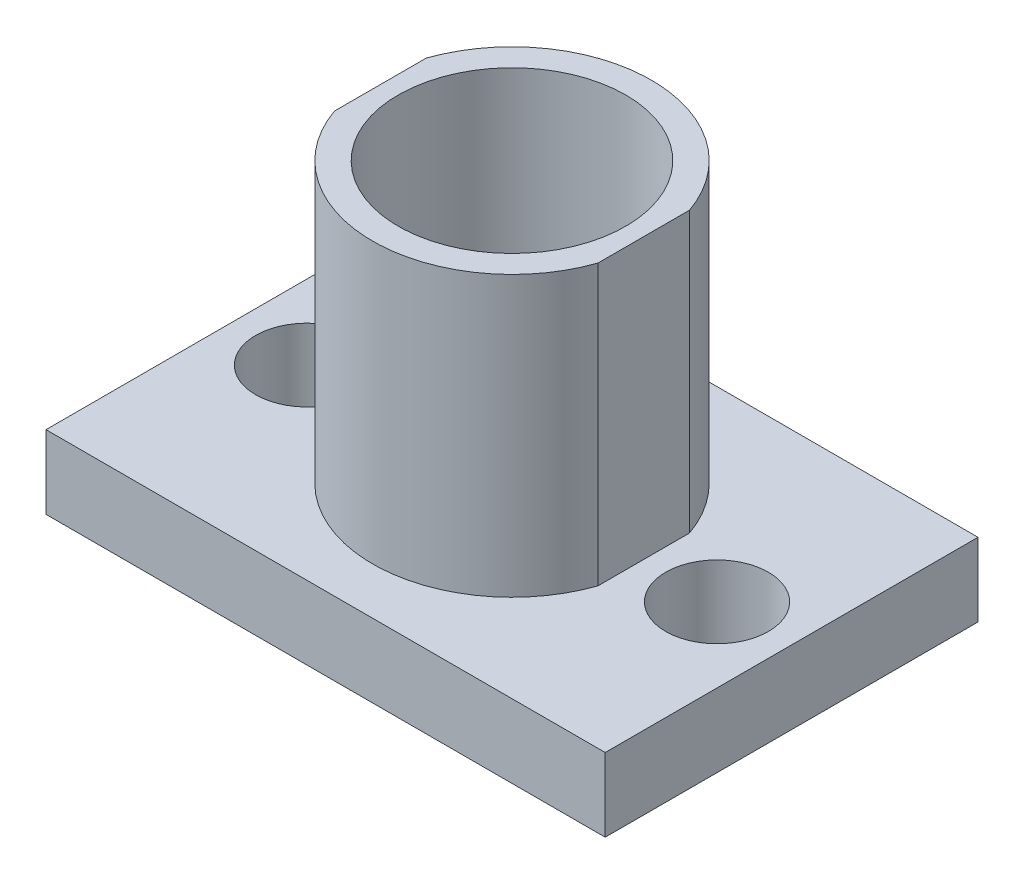
from build123d import *

# Parameters (mm, degrees)
SKETCH1_W           = 38.1
SKETCH1_H           = 25.4
BOSS_EXTRUDE1_DEPTH = 5
SKETCH3_R           = 9.5
SKETCH3_R_2         = 7.75
BOSS_EXTRUDE2_DEPTH = 19.05
SKETCH4_R           = 3.5
CUT_EXTRUDE1_DEPTH  = 35.525178946
SKETCH5_W           = 1.6
SKETCH5_H           = 10
CUT_EXTRUDE2_DEPTH  = 35.525178946


with BuildPart() as part:
    # Sketch1 → Boss-Extrude1 (new body)
    with BuildSketch(Plane(origin=(0, 0, 0), x_dir=(1, 0, 0), z_dir=(0, 1, 0))):
        with Locations((-6.79173913, 0)):
            Rectangle(SKETCH1_W, SKETCH1_H)
    extrude(amount=BOSS_EXTRUDE1_DEPTH)

    # Sketch3 → Boss-Extrude2 (add)
    with BuildSketch(Plane(origin=(0, 5, 0), x_dir=(1, 0, 0), z_dir=(0, 1, 0))):
        with Locations((-6.79173913, 0)):
            Circle(SKETCH3_R)
        with Locations((-6.79173913, 0)):
            Circle(SKETCH3_R_2, mode=Mode.SUBTRACT)
    extrude(amount=BOSS_EXTRUDE2_DEPTH)

    # Sketch4 → Cut-Extrude1 (cut, through all)
    with BuildSketch(Plane(origin=(0, 5, 0), x_dir=(1, 0, 0), z_dir=(0, 1, 0))):
        with Locations((7.17826087, 0)):
            Circle(SKETCH4_R)
        with Locations((-20.76173913, 0)):
            Circle(SKETCH4_R)
    extrude(amount=-CUT_EXTRUDE1_DEPTH, mode=Mode.SUBTRACT)

    # Sketch5 → Cut-Extrude2 (cut, through all)
    with BuildSketch(Plane(origin=(0, 5, 0), x_dir=(1, 0, 0), z_dir=(0, 1, 0))):
        with Locations((-16.563639087, -0.415081282)):
            Rectangle(SKETCH5_W, SKETCH5_H)
        with Locations((2.980160826, -0.415081282)):
            Rectangle(SKETCH5_W, SKETCH5_H)
    extrude(amount=CUT_EXTRUDE2_DEPTH, mode=Mode.SUBTRACT)


solid = part.part
